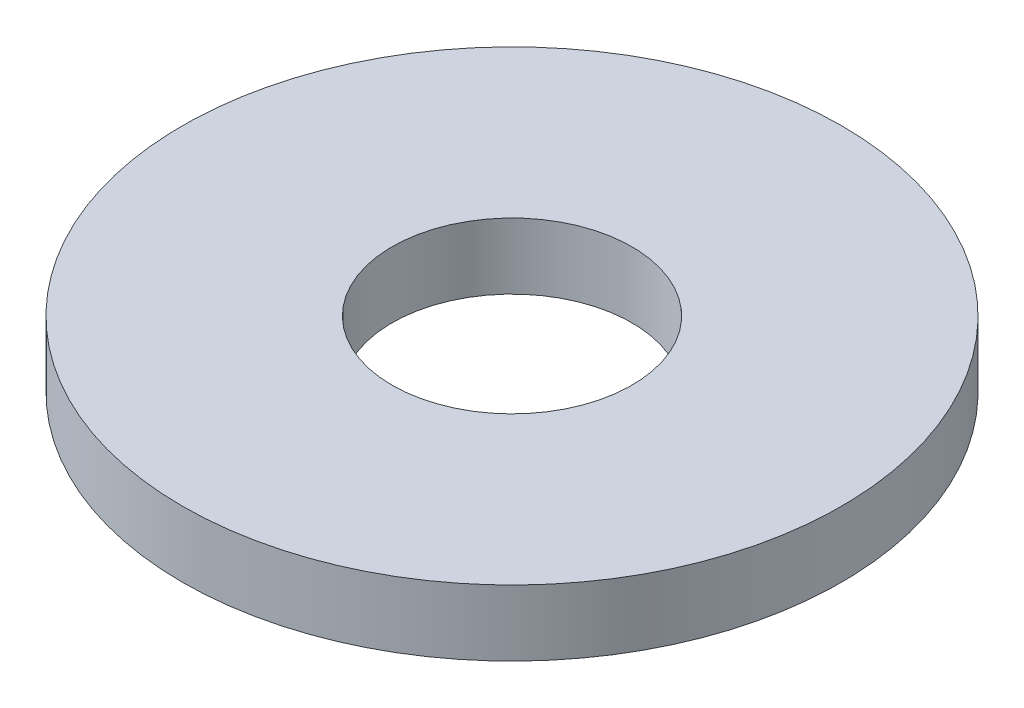
from build123d import *

# Parameters (mm, degrees)
SKETCH1_R           = 12.5
SKETCH1_R_2         = 4.55
BOSS_EXTRUDE1_DEPTH = 1.25


with BuildPart() as part:
    # Sketch1 → Boss-Extrude1 (new, symmetric)
    with BuildSketch(Plane(origin=(0, 0, 0), x_dir=(1, 0, 0), z_dir=(0, 1, 0))):
        with Locations(Location((0, 0, 0), (0, 0, 270))):
            Circle(SKETCH1_R)
        with Locations(Location((0, 0, 0), (0, 0, 270))):
            Circle(SKETCH1_R_2, mode=Mode.SUBTRACT)
    extrude(amount=BOSS_EXTRUDE1_DEPTH, both=True)


solid = part.part
